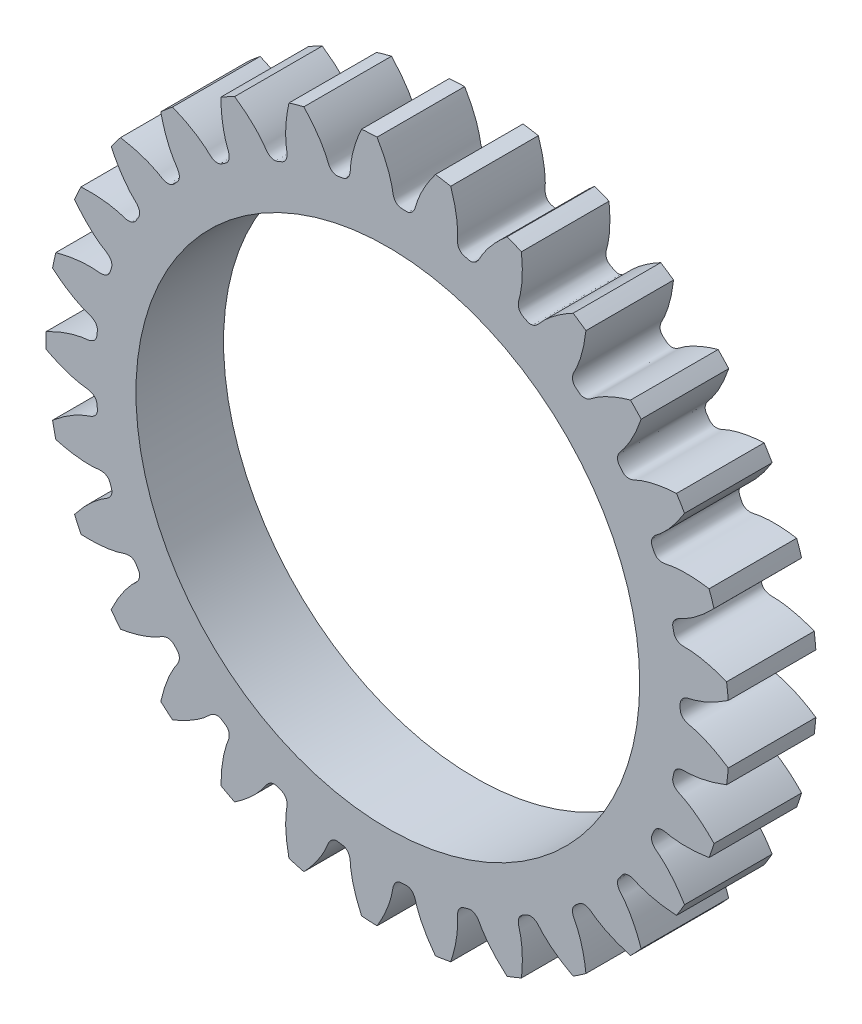
from build123d import *

# Parameters (mm, degrees)
SKETCHREVOLVESPURGEAR_W       = 4
SKETCHREVOLVESPURGEAR_H       = 15.599999767
TOOTHEXTRUDECUTSPURGEAR_DEPTH = 2
PATTERNSPURGEAR_COUNT         = 29
BOREREVOLVESKETCH_W           = 4
BOREREVOLVESKETCH_H           = 11.5


with BuildPart() as part:
    # SketchRevolveSpurGear → SpurGear (revolve)
    with BuildSketch(Plane(origin=(0, 0, 0), x_dir=(0, 0, -1), z_dir=(1, 0, 0))):
        with Locations((0, 7.799999884)):
            Rectangle(SKETCHREVOLVESPURGEAR_W, SKETCHREVOLVESPURGEAR_H)
    revolve(axis=Axis((0, 0, 0), (0, 0, -1)))

    # SketchToothSpurGear → ToothExtrudeCutSpurGear (cut, symmetric)
    with BuildSketch(Plane.XY):
        with BuildLine():
            ThreePointArc((15.594908323, 1.370347433), (15.654999766, 0), (15.594908323, -1.370347433))
            add(Edge.make_bspline(
                [(15.594908323, -1.370347433), (15.488374285, -1.297076395), (15.329786023, -1.193754749), (15.118420764, -1.067952695), (14.969885396, -0.984770667), (14.827608773, -0.909951339), (14.691922956, -0.843103489), (14.563143599, -0.783824319), (14.441569756, -0.731699689), (14.327482871, -0.686306549), (14.221148658, -0.647207308), (14.122809465, -0.613971143), (14.032707919, -0.586107033), (13.951009405, -0.563282547), (13.835820275, -0.533837087), (13.728751067, -0.515230227), (13.633880282, -0.481233954), (13.585133797, -0.459550256), (13.536700208, -0.432397606), (13.48773836, -0.397157717), (13.438371704, -0.349554401), (13.391715513, -0.284174614), (13.358838859, -0.201977616), (13.346115905, -0.103925073), (13.352142086, 0), (13.346115905, 0.103925073), (13.358838859, 0.201977616), (13.391715513, 0.284174614), (13.438371704, 0.349554401), (13.48773836, 0.397157717), (13.536700208, 0.432397606), (13.585133797, 0.459550256), (13.633880282, 0.481233954), (13.728751067, 0.515230227), (13.835820275, 0.533837087), (13.951009405, 0.563282547), (14.032707919, 0.586107033), (14.122809465, 0.613971143), (14.221148658, 0.647207308), (14.327482871, 0.686306549), (14.441569756, 0.731699689), (14.563143599, 0.783824319), (14.691922956, 0.843103489), (14.827608773, 0.909951339), (14.969885396, 0.984770667), (15.118420764, 1.067952695), (15.329786023, 1.193754749), (15.488374285, 1.297076395), (15.594908323, 1.370347433)],
                knots=[0, 0, 0, 0, 0.069922101, 0.102317144, 0.133001514, 0.161975211, 0.189238237, 0.21479059, 0.238632271, 0.26076328, 0.281183617, 0.299893282, 0.316892274, 0.332180594, 0.345758242, 0.381199491, 0.390681954, 0.400184699, 0.410023186, 0.420657346, 0.432722885, 0.446953106, 0.463781115, 0.480022333, 0.5, 0.519977667, 0.536218885, 0.553046894, 0.567277115, 0.579342654, 0.589976814, 0.599815301, 0.609318046, 0.618800509, 0.654241758, 0.667819406, 0.683107726, 0.700106718, 0.718816383, 0.73923672, 0.761367729, 0.78520941, 0.810761763, 0.838024789, 0.866998486, 0.897682856, 0.930077899, 1, 1, 1, 1], degree=3))
        make_face()
    toothextrudecutspurgear = extrude(amount=TOOTHEXTRUDECUTSPURGEAR_DEPTH, both=True, mode=Mode.SUBTRACT)

    # PatternSpurGear: ToothExtrudeCutSpurGear ×29 about axis
    patternspurgear_axis = Axis((0, 0, 55), (0, 0, -1))
    for i in range(1, PATTERNSPURGEAR_COUNT):
        add(toothextrudecutspurgear.rotate(patternspurgear_axis, i * 360 / PATTERNSPURGEAR_COUNT), mode=Mode.SUBTRACT)

    # BoreRevolveSketch → BoreRevolveCut (revolve, cut)
    with BuildSketch(Plane(origin=(0, 0, 0), x_dir=(0, 0, -1), z_dir=(1, 0, 0))):
        with Locations((0, 5.75)):
            Rectangle(BOREREVOLVESKETCH_W, BOREREVOLVESKETCH_H)
    revolve(axis=Axis((0, 0, 0), (0, 0, -1)), mode=Mode.SUBTRACT)


solid = part.part
